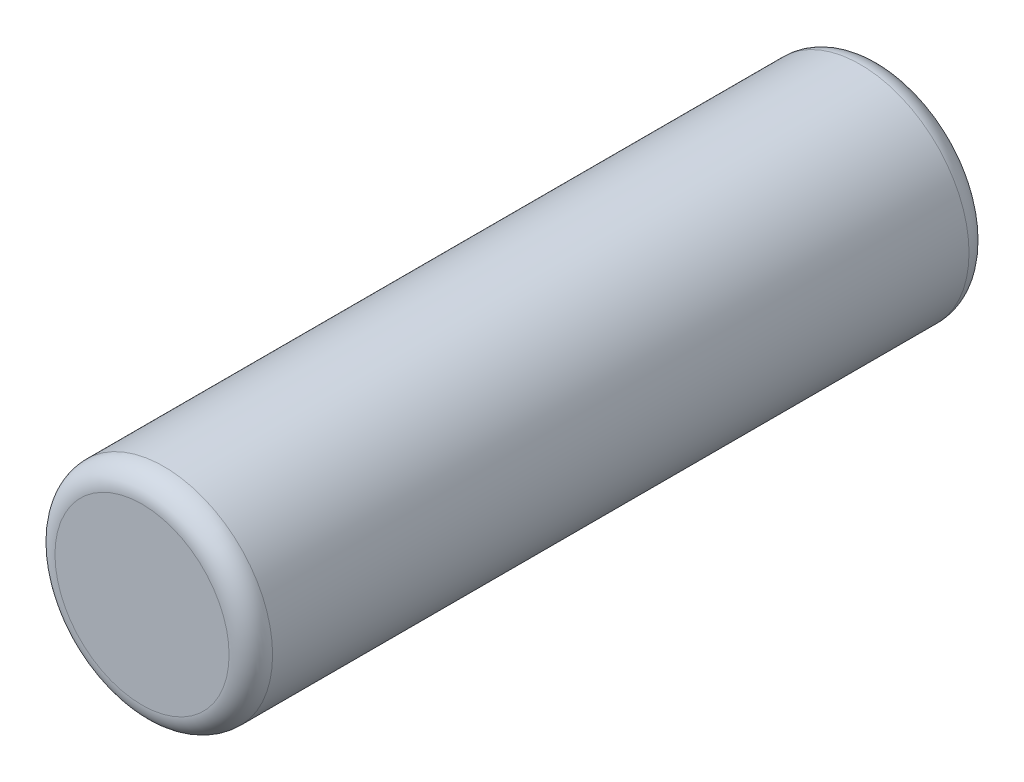
from build123d import *

# Parameters (mm, degrees)
ESBO_O2_R                = 10
RESSALTO_EXTRUS_O1_DEPTH = 34
FILETE1_R                = 2


with BuildPart() as part:
    # Esboço2 → Ressalto-extrusão1 (new, symmetric)
    with BuildSketch(Plane.XY):
        Circle(ESBO_O2_R)
    extrude(amount=RESSALTO_EXTRUS_O1_DEPTH, both=True)

    # Filete1
    filete1_edges = [part.edges().sort_by_distance(p)[0] for p in [
        (-10, 0, -34),
        (-10, 0, 34),
    ]]
    fillet(filete1_edges, radius=FILETE1_R)


solid = part.part
